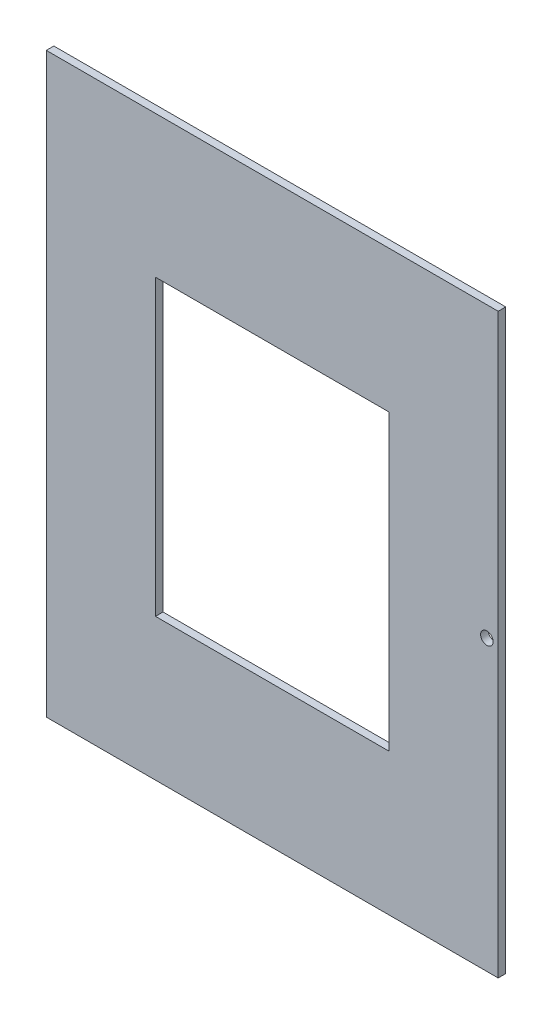
from build123d import *

# Parameters (mm, degrees)
CROQUIS1_W              = 180
CROQUIS1_H              = 230
CROQUIS1_R              = 2.5
SALIENTE_EXTRUIR1_DEPTH = 3


with BuildPart() as part:
    # Croquis1 → Saliente-Extruir1 (new body)
    with BuildSketch(Plane.XY):
        with Locations((90, -115)):
            Rectangle(CROQUIS1_W, CROQUIS1_H)
        with Locations((175.5, -115)):
            Circle(CROQUIS1_R, mode=Mode.SUBTRACT)
        Polygon((90, -56.5), (136.5, -56.5), (136.5, -173.5), (43.5, -173.5), (43.5, -56.5), align=None, mode=Mode.SUBTRACT)
    extrude(amount=SALIENTE_EXTRUIR1_DEPTH)


solid = part.part
